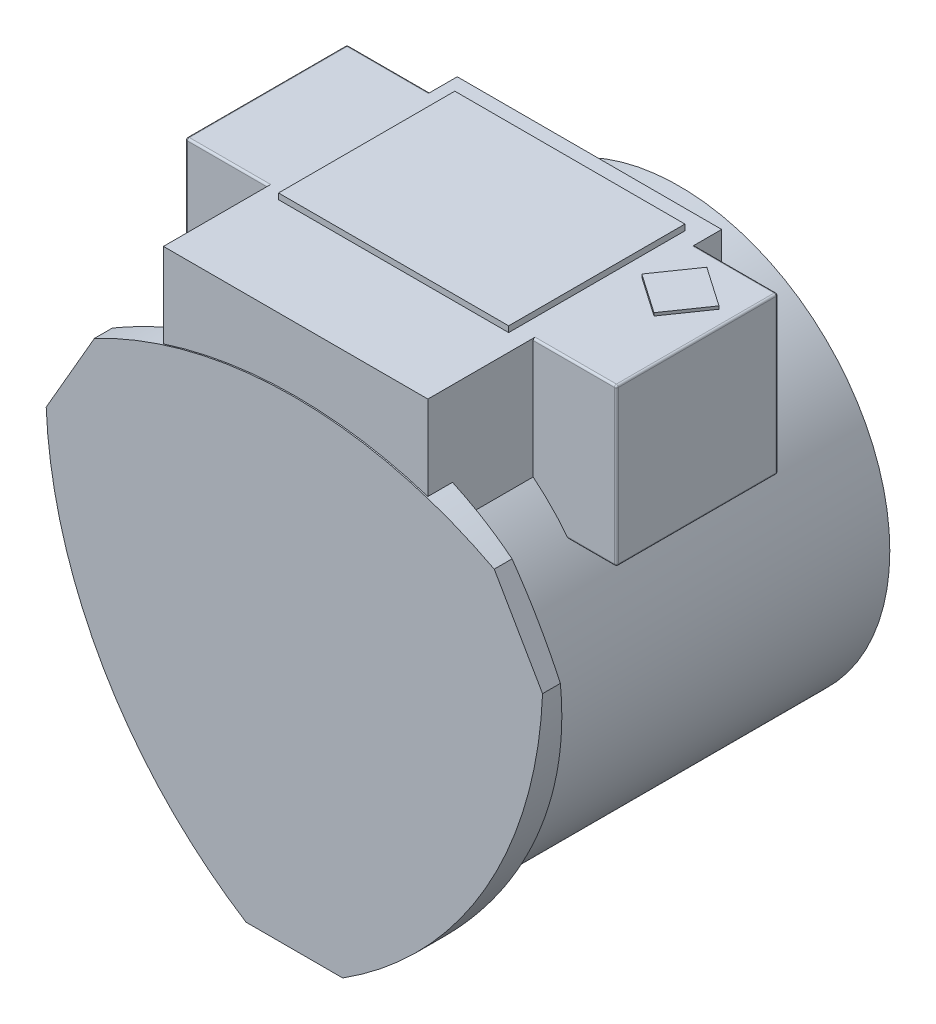
from build123d import *

# Parameters (mm, degrees)
SKETCH_1_R          = 215
EXTRUDE_1_DEPTH     = 363
CUT_EXTRUDE_1_DEPTH = 107
EXTRUDE_4_DEPTH     = 160
SKETCH_10_W         = 235
SKETCH_10_H         = 180
EXTRUDE_5_DEPTH     = 6
FILLET_3_R          = 2
EXTRUDE_20_DEPTH    = 3
SKETCH_34_R         = 50
EXTRUDE_21_DEPTH    = 10


with BuildPart() as part:
    # 草图1 → 凸台-拉伸1 (new body)
    with BuildSketch(Plane.XY):
        Circle(SKETCH_1_R)
    extrude(amount=EXTRUDE_1_DEPTH)

    # 草图4 → 旋转1 (revolve)
    with BuildSketch(Plane(origin=(0, 0, 0), x_dir=(1, 0, 0), z_dir=(0, 1, 0))):
        with BuildLine():
            Line((314.629571523, -393), (0, -393))
            Line((0, -393), (0, -327.907704376))
            ThreePointArc((0, -327.907704376), (160.646175045, -344.351277025), (314.629571523, -393))
        make_face()
    revolve(axis=Axis((0, 0, -172.638889366), (0, 0, 1)))

    # 草图5 → 切除-拉伸-薄壁1 (cut)
    with BuildSketch(Plane.XY.offset(393)):
        with BuildLine():
            Line((351.165178373, 320.054219213), (452.757673614, 144.090855789))
            ThreePointArc((452.757673614, 144.090855789), (368.060796608, -212.5), (101.592495241, -464.145075002))
            Line((101.592495241, -464.145075002), (-101.592495241, -464.145075002))
            ThreePointArc((-101.592495241, -464.145075002), (-368.060796608, -212.5), (-452.757673614, 144.090855789))
            Line((-452.757673614, 144.090855789), (-351.165178373, 320.054219213))
            ThreePointArc((-351.165178373, 320.054219213), (0, 425), (351.165178373, 320.054219213))
        make_face()
        with BuildLine():
            Line((204.083177545, 174.807717526), (253.429512928, 89.337357476))
            ThreePointArc((253.429512928, 89.337357476), (194.855715852, -112.5), (49.346335383, -264.145075002))
            Line((49.346335383, -264.145075002), (-49.346335383, -264.145075002))
            ThreePointArc((-49.346335383, -264.145075002), (-194.855715852, -112.5), (-253.429512928, 89.337357476))
            Line((-253.429512928, 89.337357476), (-204.083177545, 174.807717526))
            ThreePointArc((-204.083177545, 174.807717526), (0, 225), (204.083177545, 174.807717526))
        make_face(mode=Mode.SUBTRACT)
    extrude(amount=-CUT_EXTRUDE_1_DEPTH, mode=Mode.SUBTRACT)

    # Sketch 3D_12 → 凸台-拉伸4 (add)
    with BuildSketch(Plane(origin=(-135, 290, 91.691157881), x_dir=(0.8790758256746, 0, 0.47668196180946526), z_dir=(0, -1, 0))):
        Polygon((0, 0), (237.350472932, -128.704129689), (250.459226882, -104.529544483), (325.180672064, -145.047511236), (403.833195763, 0), (329.11175058, 40.517966754), (380.355061475, 135.018618014), (143.004588543, 263.722747702), (91.761277648, 169.222096442), (17.039832466, 209.740063196), (-61.612691233, 64.69255196), (13.10875395, 24.174585206), align=None)
    extrude(amount=EXTRUDE_4_DEPTH)

    # 草图10 → 凸台-拉伸5 (add)
    with BuildSketch(Plane(origin=(0, 290, 0), x_dir=(1, 0, 0), z_dir=(0, 1, 0))):
        with Locations((0, -201.691157881)):
            Rectangle(SKETCH_10_W, SKETCH_10_H)
    extrude(amount=EXTRUDE_5_DEPTH)

    # 圆角3
    fillet_3_edges = [part.edges().sort_by_distance(p)[0] for p in [
        (-220, 210, 119.191157881),
        (-220, 290, 201.691157881),
        (-220, 210, 284.191157881),
        (-220, 130, 201.691157881),
        (220, 210, 284.191157881),
        (220, 290, 201.691157881),
        (220, 210, 119.191157881),
        (220, 130, 201.691157881),
        (-195.622718948, 130, 119.191157881),
        (-195.622718948, 130, 284.191157881),
        (-177.5, 290, 284.191157881),
        (-177.5, 290, 119.191157881),
        (195.622718948, 130, 284.191157881),
        (195.622718948, 130, 119.191157881),
        (177.5, 290, 284.191157881),
        (177.5, 290, 119.191157881),
    ]]
    fillet(fillet_3_edges, radius=FILLET_3_R)

    # 草图33 → 凸台-拉伸20 (add)
    with BuildSketch(Plane(origin=(0, 290, 0), x_dir=(1, 0, 0), z_dir=(0, 1, 0))):
        Polygon((163.818584795, -135.701340735), (204.207179399, -163.66267546), (177.072288064, -202.8575185), (136.68369346, -174.896183774), align=None)
    extrude(amount=EXTRUDE_20_DEPTH)

    # 草图34 → 凸台-拉伸21 (add)
    with BuildSketch(Plane(origin=(0, 0, 0), x_dir=(-1, 0, 0), z_dir=(0, 0, -1))):
        with Locations(Location((0, 0, 0), (0, 0, 180))):
            Circle(SKETCH_34_R)
    extrude(amount=EXTRUDE_21_DEPTH)


solid = part.part
